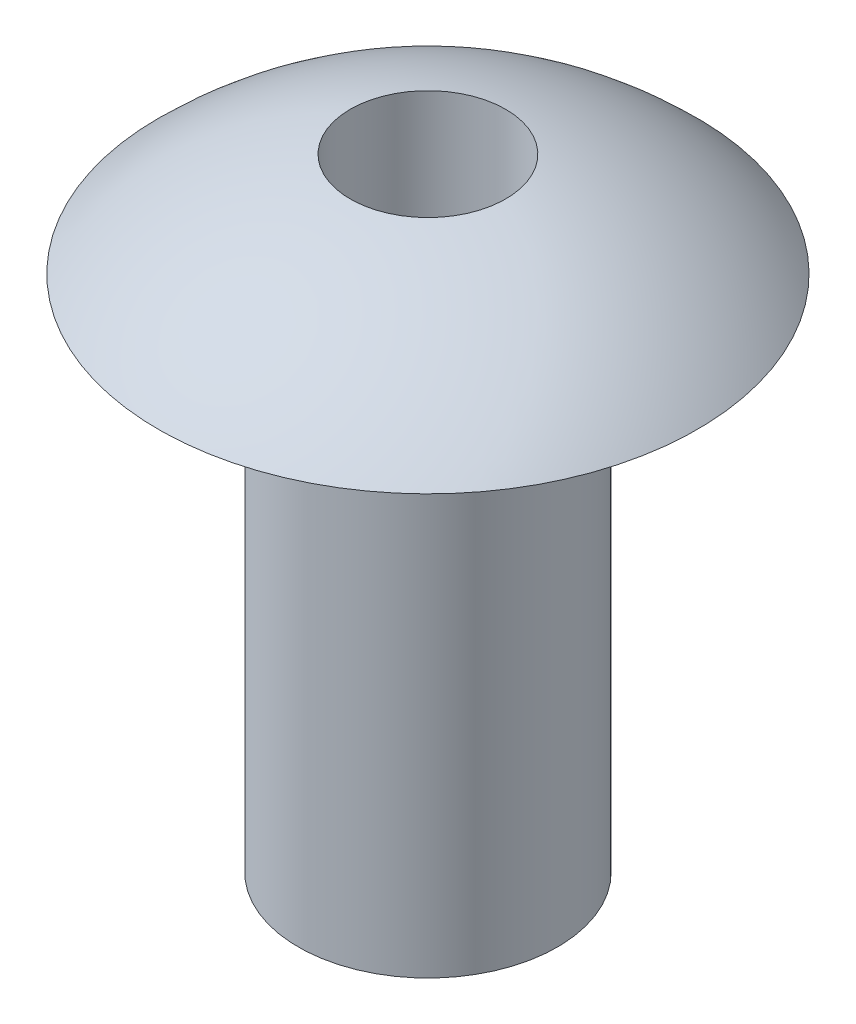
from build123d import *


with BuildPart() as part:
    # 草图1 → 旋转1 (revolve)
    with BuildSketch(Plane.XY, mode=Mode.PRIVATE) as revolve_1_sk:
        with BuildLine():
            Line((0, -2.8815), (-1.5, -2.8815))
            Line((-1.5, -2.8815), (-1.5, 3.1185))
            Line((-1.5, 3.1185), (-3.12, 3.1185))
            ThreePointArc((-3.12, 3.1185), (-2.097641533, 3.880636836), (-0.9, 4.3185))
            Line((-0.9, 4.3185), (-0.9, 1.9185))
            Line((-0.9, 1.9185), (0, 1.9185))
            Line((0, 1.9185), (0, -2.8815))
        make_face()
    revolve(revolve_1_sk.sketch.rotate(Axis((0, -2.8815, 0), (0, 1, 0)), 270), axis=Axis((0, -2.8815, 0), (0, 1, 0)))


solid = part.part
